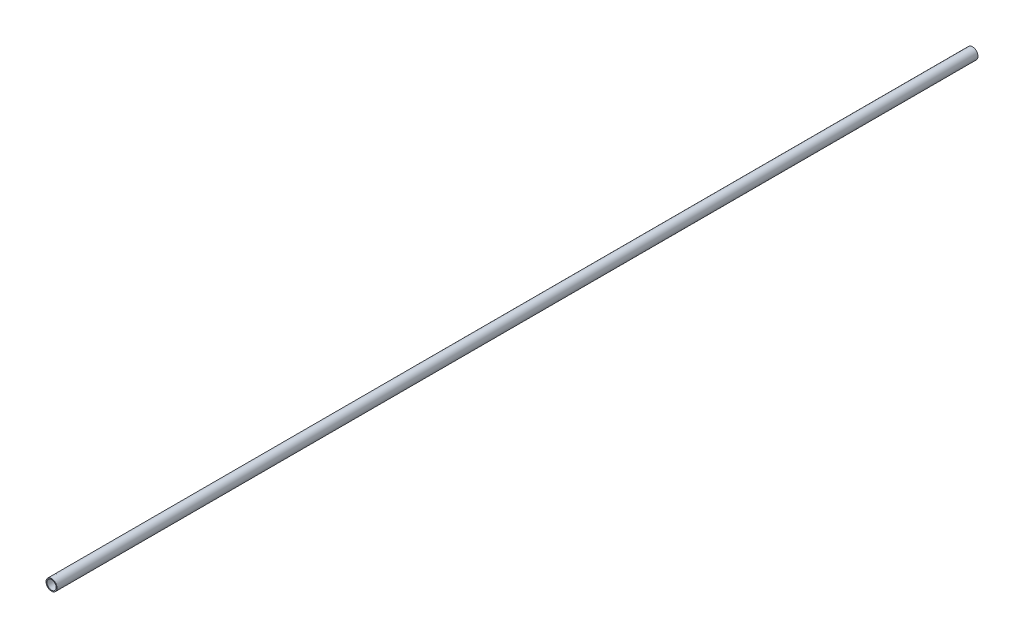
from build123d import *

# Parameters (mm, degrees)
SKETCH_1_R      = 6
SKETCH_1_R_2    = 5
EXTRUDE_1_DEPTH = 1000


with BuildPart() as part:
    # ｽｹｯﾁ1 → ﾎﾞｽ - 押し出し1 (new body)
    with BuildSketch(Plane.XY):
        Circle(SKETCH_1_R)
        Circle(SKETCH_1_R_2, mode=Mode.SUBTRACT)
    extrude(amount=EXTRUDE_1_DEPTH)


solid = part.part
